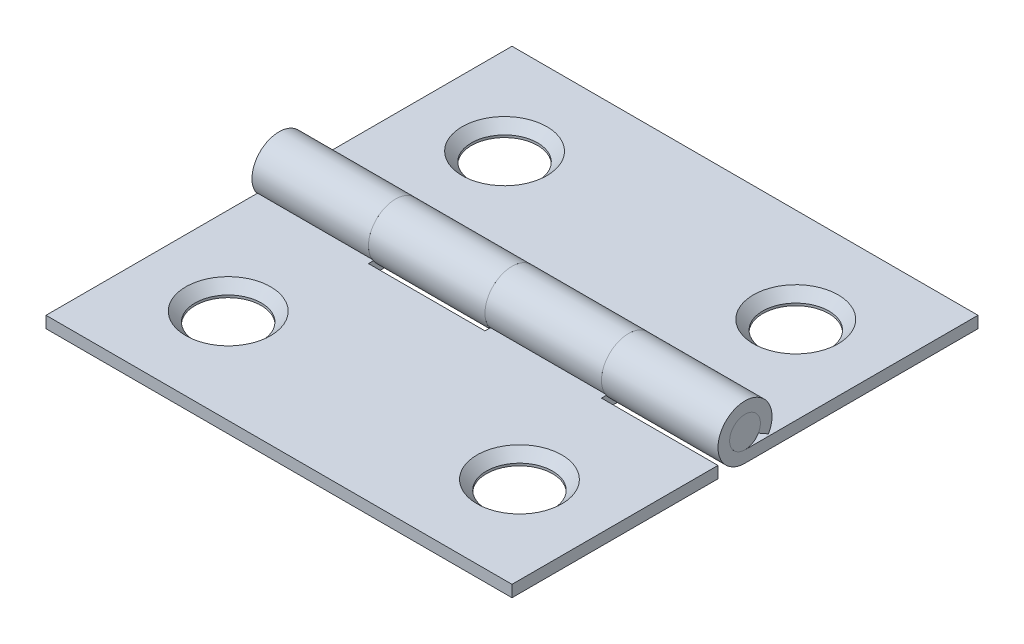
from build123d import *

# Parameters (mm, degrees)
BOSS_EXTRUDE1_DEPTH     = 12.7
SKETCH4_W               = 6.35
SKETCH4_H               = 2.9464
CUT_EXTRUDE1_DEPTH      = 19.020830121
LPATTERN1_COUNT         = 6
LPATTERN1_PITCH         = 12.7
CUT_EXTRUDE3_DEPTH      = 19.020830121
CUT_EXTRUDE3_DEPTH_BACK = 19.020830121
SKETCH9_R               = 1.8034
CIRPATTERN1_COUNT       = 2
SKETCH6_R               = 0.8382
BOSS_EXTRUDE2_DEPTH     = 12.7


with BuildPart() as part:
    # Sketch3 → Boss-Extrude1 (new, symmetric)
    with BuildSketch(Plane(origin=(0, 0, 0), x_dir=(0, 0, -1), z_dir=(1, 0, 0))):
        with BuildLine():
            Line((0, -1.4732), (-12.7, -1.4732))
            Line((-12.7, -1.4732), (-12.7, -0.8382))
            Line((-12.7, -0.8382), (0, -0.8382))
            ThreePointArc((0, -0.8382), (0.421388638, 0.724576328), (-0.728533124, -0.414510226))
            Line((-0.728533124, -0.414510226), (-1.280452157, -0.728533124))
            ThreePointArc((-1.280452157, -0.728533124), (0.740622455, 1.273497789), (0, -1.4732))
        make_face()
    extrude(amount=BOSS_EXTRUDE1_DEPTH, both=True)

    # Sketch4 → Cut-Extrude1 (cut, symmetric)
    with BuildSketch(Plane(origin=(0, 0, 0), x_dir=(1, 0, 0), z_dir=(0, 1, 0))):
        with Locations((-3.175, 0)):
            Rectangle(SKETCH4_W, SKETCH4_H)
    cut_extrude1 = extrude(amount=CUT_EXTRUDE1_DEPTH, both=True, mode=Mode.SUBTRACT)

    # LPattern1: Cut-Extrude1 ×6
    with Locations(*[(i * LPATTERN1_PITCH, 0, 0) for i in range(1, LPATTERN1_COUNT)]):
        add(cut_extrude1, mode=Mode.SUBTRACT)

    # Cut-Extrude2 cone 1 section (through the dimple's axis) → Cut-Extrude2 (revolve, cut)
    with BuildSketch(Plane(origin=(7.9502, -0.8382, 7.5438), x_dir=(0, 0, 1), z_dir=(1, 0, 0))):
        Polygon((0, 0), (2.3114, 0), (0, 2.3114), align=None)
    revolve(axis=Axis((7.9502, -0.8382, 7.5438), (0, -1, 0)), mode=Mode.SUBTRACT)

    # Cut-Extrude2 cone 2 section (through the dimple's axis) → Cut-Extrude2 cone 2 (revolve, cut)
    with BuildSketch(Plane(origin=(-7.9248, -0.8382, 7.5438), x_dir=(0, 0, 1), z_dir=(1, 0, 0))):
        Polygon((0, 0), (2.3114, 0), (0, 2.3114), align=None)
    revolve(axis=Axis((-7.9248, -0.8382, 7.5438), (0, -1, 0)), mode=Mode.SUBTRACT)

    # Sketch9 → Cut-Extrude3 (cut, two sides: drawn at the far end of the back side and taken through both)
    with BuildSketch(Plane(origin=(0, 0, 0), x_dir=(1, 0, 0), z_dir=(0, 1, 0)).offset(-CUT_EXTRUDE3_DEPTH_BACK)):
        with Locations(Location((7.9502, -7.5438, 0), (0, 0, 270))):
            Circle(SKETCH9_R)
        with Locations(Location((-7.9248, -7.5438, 0), (0, 0, 270))):
            Circle(SKETCH9_R)
    extrude(amount=CUT_EXTRUDE3_DEPTH + CUT_EXTRUDE3_DEPTH_BACK, mode=Mode.SUBTRACT)


with BuildPart() as cirpattern1_1:
    # CirPattern1: pattern copy
    add(part.part.rotate(Axis((0, 0, 0), (0, 1, 0)), 1 * 360 / CIRPATTERN1_COUNT))


with BuildPart() as body_3:
    # Sketch6 → Boss-Extrude2 (new, symmetric)
    with BuildSketch(Plane(origin=(0, 0, 0), x_dir=(0, 0, -1), z_dir=(1, 0, 0))):
        Circle(SKETCH6_R)
    extrude(amount=BOSS_EXTRUDE2_DEPTH, both=True)


solid = Compound([part.part, cirpattern1_1.part, body_3.part])
